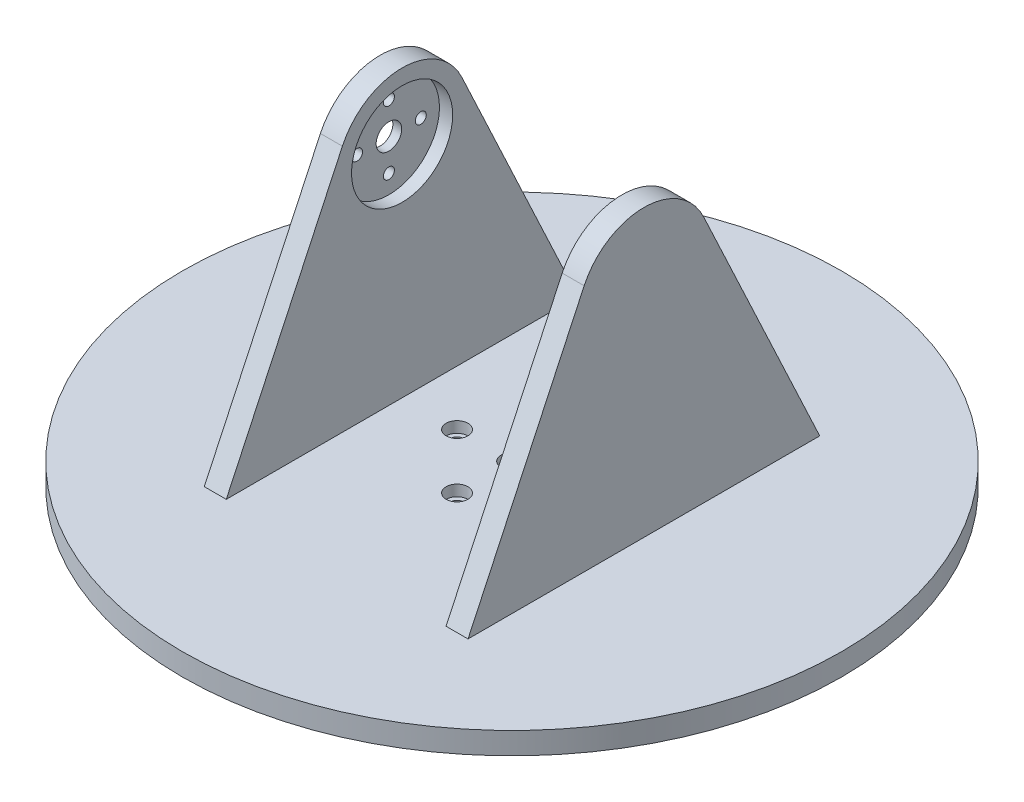
from build123d import *

# Parameters (mm, degrees)
SKETCH1_R           = 75
BOSS_EXTRUDE1_DEPTH = 5
BOSS_EXTRUDE2_DEPTH = 5
BOSS_EXTRUDE3_START = -5
BOSS_EXTRUDE3_DEPTH = 5
SKETCH6_R           = 1.5
CUT_EXTRUDE1_DEPTH  = 5
SKETCH7_R           = 2.9
CUT_EXTRUDE2_DEPTH  = 2.5
SKETCH8_R           = 0.6
CUT_EXTRUDE3_DEPTH  = 5
CIRPATTERN1_COUNT   = 4
SKETCH10_R          = 1.25
CUT_EXTRUDE4_DEPTH  = 3
CIRPATTERN2_COUNT   = 4
SKETCH11_R          = 1.5
CUT_EXTRUDE5_DEPTH  = 5
SKETCH12_R          = 1.5
CUT_EXTRUDE6_DEPTH  = 5
CIRPATTERN3_COUNT   = 4
SKETCH13_R          = 2.488262112
CUT_EXTRUDE7_DEPTH  = 2.5
CIRPATTERN4_COUNT   = 4
SKETCH14_R          = 2.461092264
CUT_EXTRUDE8_DEPTH  = 2.5
SKETCH16_R          = 11.5
CUT_EXTRUDE10_DEPTH = 3


with BuildPart() as part:
    # Sketch1 → Boss-Extrude1 (new body)
    with BuildSketch(Plane(origin=(0, 0, 0), x_dir=(1, 0, 0), z_dir=(0, 1, 0))):
        with Locations(Location((0, 0, 0), (0, 0, 270))):
            Circle(SKETCH1_R)
    extrude(amount=BOSS_EXTRUDE1_DEPTH)

    # Sketch4 → Boss-Extrude2 (add)
    with BuildSketch(Plane.ZY.offset(25)):
        with BuildLine():
            Line((-13.582225242, 61.365780194), (-40, 5))
            Line((-40, 5), (40, 5))
            Line((40, 5), (13.582225242, 61.365780194))
            ThreePointArc((13.582225242, 61.365780194), (0, 70), (-13.582225242, 61.365780194))
        make_face()
    extrude(amount=BOSS_EXTRUDE2_DEPTH)

    # Sketch5 → Boss-Extrude3 (add)
    with BuildSketch(Plane.ZY.offset(-25).offset(BOSS_EXTRUDE3_START)):
        with BuildLine():
            Line((13.582225242, 61.365780194), (40, 5))
            Line((40, 5), (-40, 5))
            Line((-40, 5), (-13.582225242, 61.365780194))
            ThreePointArc((-13.582225242, 61.365780194), (0, 70), (13.582225242, 61.365780194))
        make_face()
    extrude(amount=BOSS_EXTRUDE3_DEPTH)

    # Sketch6 → Cut-Extrude1 (cut)
    with BuildSketch(Plane.ZY.offset(30)):
        with Locations((0, 55)):
            Circle(SKETCH6_R)
    extrude(amount=-CUT_EXTRUDE1_DEPTH, mode=Mode.SUBTRACT)

    # Sketch7 → Cut-Extrude2 (cut)
    with BuildSketch(Plane.ZY.offset(30)):
        with Locations((0, 55)):
            Circle(SKETCH7_R)
    extrude(amount=-CUT_EXTRUDE2_DEPTH, mode=Mode.SUBTRACT)

    # Sketch8 → Cut-Extrude3 (cut)
    with BuildSketch(Plane.ZY.offset(30)):
        with Locations((0, 62.25)):
            Circle(SKETCH8_R)
    cut_extrude3 = extrude(amount=-CUT_EXTRUDE3_DEPTH, mode=Mode.SUBTRACT)

    # CirPattern1: Cut-Extrude3 ×4 about axis
    cirpattern1_axis = Axis((0, 55, 0), (1, 0, 0))
    for i in range(1, CIRPATTERN1_COUNT):
        add(cut_extrude3.rotate(cirpattern1_axis, i * 360 / CIRPATTERN1_COUNT), mode=Mode.SUBTRACT)

    # Sketch10 → Cut-Extrude4 (cut)
    with BuildSketch(Plane.ZY.offset(30)):
        with Locations((0, 62.25)):
            Circle(SKETCH10_R)
    cut_extrude4 = extrude(amount=-CUT_EXTRUDE4_DEPTH, mode=Mode.SUBTRACT)

    # CirPattern2: Cut-Extrude4 ×4 about axis
    cirpattern2_axis = Axis((0, 55, 0), (1, 0, 0))
    for i in range(1, CIRPATTERN2_COUNT):
        add(cut_extrude4.rotate(cirpattern2_axis, i * 360 / CIRPATTERN2_COUNT), mode=Mode.SUBTRACT)

    # Sketch11 → Cut-Extrude5 (cut)
    with BuildSketch(Plane(origin=(0, 5, 0), x_dir=(1, 0, 0), z_dir=(0, 1, 0))):
        with Locations(Location((0, 0, 0), (0, 0, 270))):
            Circle(SKETCH11_R)
    extrude(amount=-CUT_EXTRUDE5_DEPTH, mode=Mode.SUBTRACT)

    # Sketch12 → Cut-Extrude6 (cut)
    with BuildSketch(Plane(origin=(0, 5, 0), x_dir=(1, 0, 0), z_dir=(0, 1, 0))):
        with Locations(Location((0, 12.5, 0), (0, 0, 270))):
            Circle(SKETCH12_R)
    cut_extrude6 = extrude(amount=-CUT_EXTRUDE6_DEPTH, mode=Mode.SUBTRACT)

    # CirPattern3: Cut-Extrude6 ×4 about axis
    cirpattern3_axis = Axis((0, 0, 0), (0, 1, 0))
    for i in range(1, CIRPATTERN3_COUNT):
        add(cut_extrude6.rotate(cirpattern3_axis, i * 360 / CIRPATTERN3_COUNT), mode=Mode.SUBTRACT)

    # Sketch13 → Cut-Extrude7 (cut)
    with BuildSketch(Plane(origin=(0, 5, 0), x_dir=(1, 0, 0), z_dir=(0, 1, 0))):
        with Locations(Location((0, 12.5, 0), (0, 0, 270))):
            Circle(SKETCH13_R)
    cut_extrude7 = extrude(amount=-CUT_EXTRUDE7_DEPTH, mode=Mode.SUBTRACT)

    # CirPattern4: Cut-Extrude7 ×4 about axis
    cirpattern4_axis = Axis((0, 0, 0), (0, 1, 0))
    for i in range(1, CIRPATTERN4_COUNT):
        add(cut_extrude7.rotate(cirpattern4_axis, i * 360 / CIRPATTERN4_COUNT), mode=Mode.SUBTRACT)

    # Sketch14 → Cut-Extrude8 (cut)
    with BuildSketch(Plane(origin=(0, 5, 0), x_dir=(1, 0, 0), z_dir=(0, 1, 0))):
        with Locations(Location((0, 0, 0), (0, 0, 270))):
            Circle(SKETCH14_R)
    extrude(amount=-CUT_EXTRUDE8_DEPTH, mode=Mode.SUBTRACT)

    # Sketch16 → Cut-Extrude10 (cut)
    with BuildSketch(Plane(origin=(-25, 0, 0), x_dir=(0, 0, -1), z_dir=(1, 0, 0))):
        with Locations((0, 55)):
            Circle(SKETCH16_R)
    extrude(amount=-CUT_EXTRUDE10_DEPTH, mode=Mode.SUBTRACT)


solid = part.part
